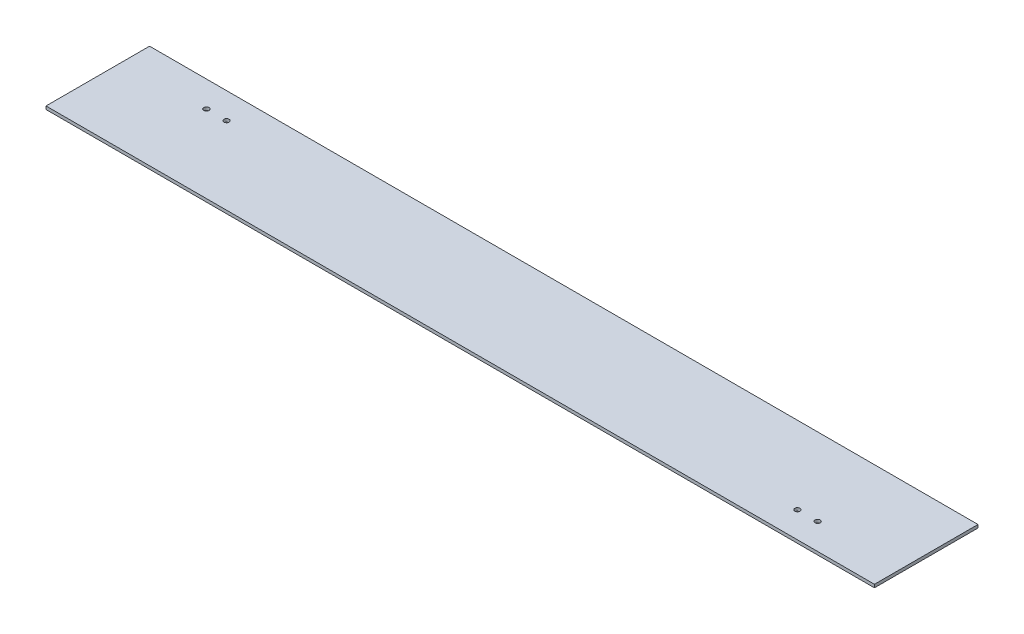
from build123d import *

# Parameters (mm, degrees)
SKETCH1_W           = 800
SKETCH1_H           = 100
BOSS_EXTRUDE1_DEPTH = 3
SKETCH2_R           = 2.5
CUT_EXTRUDE1_DEPTH  = 40


with BuildPart() as part:
    # Sketch1 → Boss-Extrude1 (new body)
    with BuildSketch(Plane(origin=(0, 0, 0), x_dir=(1, 0, 0), z_dir=(0, 1, 0))):
        with Locations((-400, 50)):
            Rectangle(SKETCH1_W, SKETCH1_H)
    extrude(amount=BOSS_EXTRUDE1_DEPTH)

    # Sketch2 → Cut-Extrude1 (cut)
    with BuildSketch(Plane(origin=(0, 3, 0), x_dir=(1, 0, 0), z_dir=(0, 1, 0))):
        with Locations(Location((-80, 25.14, 0), (0, 0, 270))):
            Circle(SKETCH2_R)
        with Locations(Location((-99.5, 25.14, 0), (0, 0, 270))):
            Circle(SKETCH2_R)
        with Locations(Location((-720, 74.86, 0), (0, 0, 270))):
            Circle(SKETCH2_R)
        with Locations(Location((-700.5, 74.86, 0), (0, 0, 270))):
            Circle(SKETCH2_R)
    extrude(amount=-CUT_EXTRUDE1_DEPTH, mode=Mode.SUBTRACT)


solid = part.part
